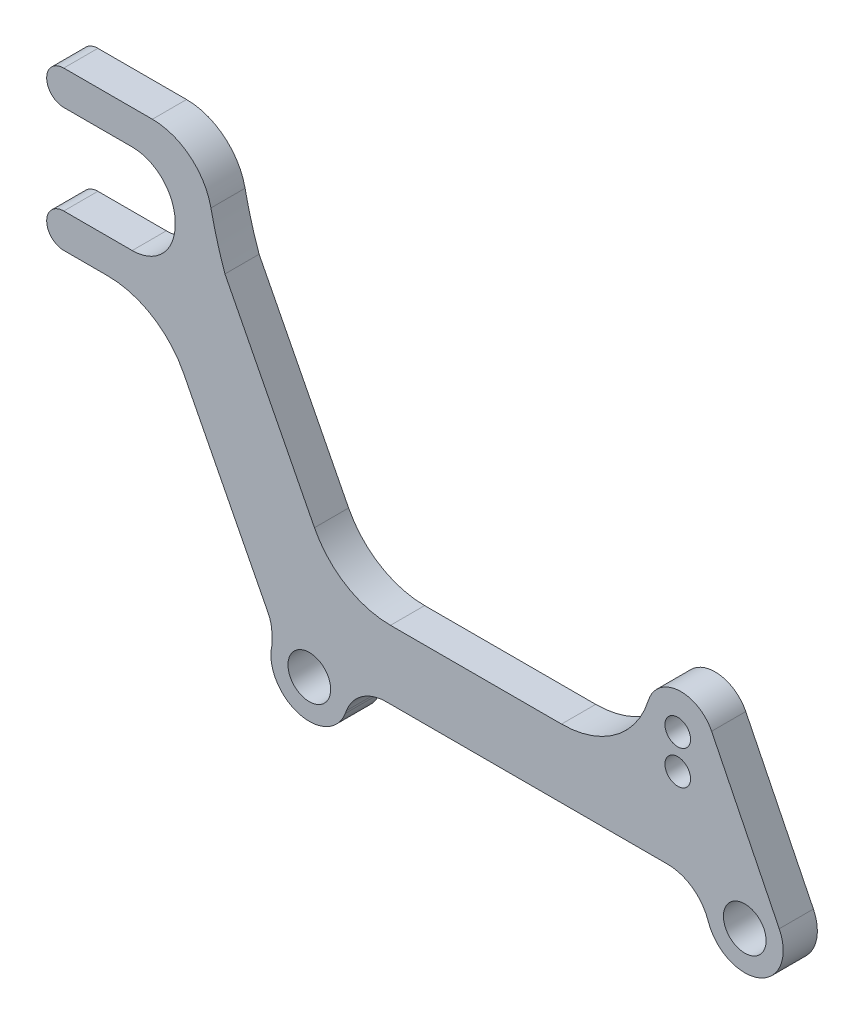
from build123d import *

# Parameters (mm, degrees)
SKETCH1_R           = 2.5
SKETCH1_R_2         = 1.5
BOSS_EXTRUDE1_DEPTH = 4


with BuildPart() as part:
    # Sketch1 → Boss-Extrude1 (new body)
    with BuildSketch(Plane.XY):
        with BuildLine():
            Line((9.021718503, 2), (41.978281497, 2))
            ThreePointArc((41.978281497, 2), (44.822515117, 1.112217786), (46.656724728, -1.235865953))
            Line((46.656724728, -1.235865953), (46.789401092, -1.587720642))
            ThreePointArc((46.789401092, -1.587720642), (52.790694487, -4.128366899), (55.036357188, 1.989427216))
            Line((55.036357188, 1.989427216), (47.115238631, 18.060617738))
            ThreePointArc((47.115238631, 18.060617738), (43.216566444, 20.280145198), (39.708839684, 17.483397096))
            ThreePointArc((39.708839684, 17.483397096), (35.851166353, 12.07387553), (29.538291134, 10.002119376))
            Line((29.538291134, 10.002119376), (9.504810122, 10.002119376))
            ThreePointArc((9.504810122, 10.002119376), (4.286155076, 11.471841566), (0.601494655, 15.448991475))
            Line((0.601494655, 15.448991475), (-9.880645528, 35.94606576))
            ThreePointArc((-9.880645528, 35.94606576), (-10.802085001, 38.853975504), (-11.524402661, 41.817629833))
            ThreePointArc((-11.524402661, 41.817629833), (-13.960734342, 45.822125323), (-18.377595021, 47.391532194))
            Line((-18.377595021, 47.391532194), (-28.76016905, 47.391532194))
            ThreePointArc((-28.76016905, 47.391532194), (-30.76016905, 45.391532194), (-28.76016905, 43.391532194))
            Line((-28.76016905, 43.391532194), (-20.743770069, 43.391532194))
            ThreePointArc((-20.743770069, 43.391532194), (-17.93067591, 42.525114327), (-16.092507767, 40.226132695))
            ThreePointArc((-16.092507767, 40.226132695), (-15.696247775, 38.141532194), (-16.092507767, 36.056931692))
            ThreePointArc((-16.092507767, 36.056931692), (-17.93067591, 33.75795006), (-20.743770069, 32.891532194))
            Line((-20.743770069, 32.891532194), (-23.62255188, 32.891532194))
            Line((-23.62255188, 32.891532194), (-28.76016905, 32.891532194))
            ThreePointArc((-28.76016905, 32.891532194), (-30.76016905, 30.891532194), (-28.76016905, 28.891532194))
            Line((-28.76016905, 28.891532194), (-23.62255188, 28.891532194))
            ThreePointArc((-23.62255188, 28.891532194), (-18.403896833, 27.421810003), (-14.719236412, 23.444660095))
            Line((-14.719236412, 23.444660095), (-4.823396458, 4.094053908))
            ThreePointArc((-4.823396458, 4.094053908), (-4.495519345, 3.207734666), (-4.38472424, 2.269230727))
            Line((-4.38472424, 2.269230727), (-4.385851303, 1.007128763))
            ThreePointArc((-4.385851303, 1.007128763), (-1.300380409, -4.308017037), (4.210598908, -1.587720642))
            Line((4.210598908, -1.587720642), (4.343275272, -1.235865953))
            ThreePointArc((4.343275272, -1.235865953), (6.177484883, 1.112217786), (9.021718503, 2))
        make_face()
        Circle(SKETCH1_R, mode=Mode.SUBTRACT)
        with Locations((51, 0)):
            Circle(SKETCH1_R, mode=Mode.SUBTRACT)
        with Locations((43.150236609, 12)):
            Circle(SKETCH1_R_2, mode=Mode.SUBTRACT)
        with Locations((43.150236609, 16)):
            Circle(SKETCH1_R_2, mode=Mode.SUBTRACT)
    extrude(amount=BOSS_EXTRUDE1_DEPTH)


solid = part.part
